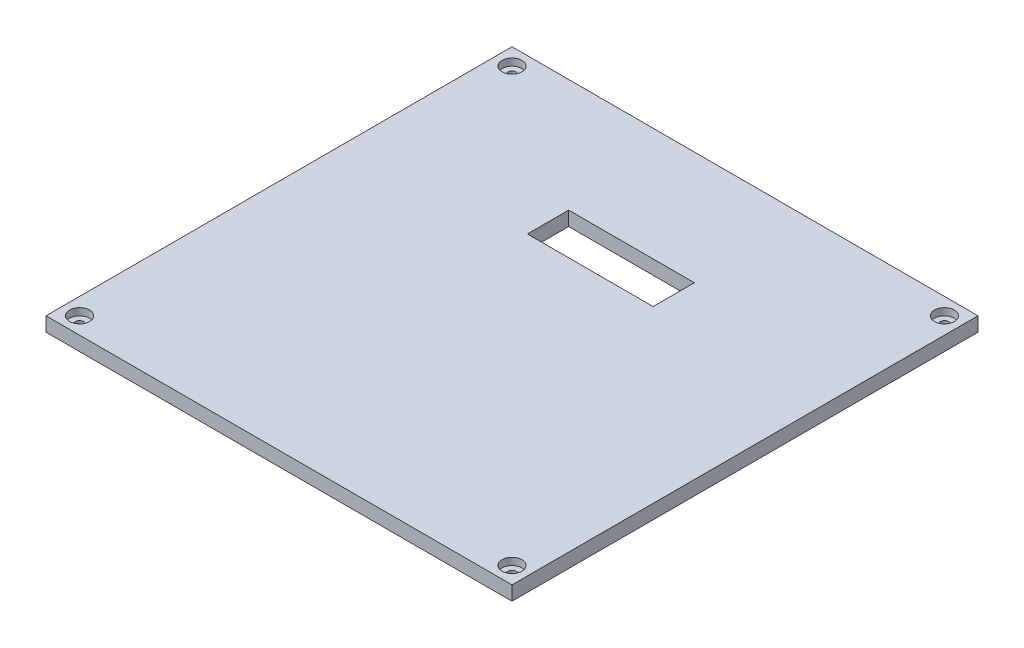
from build123d import *

# Parameters (mm, degrees)
SKETCH1_W                                  = 416.08
SKETCH1_H                                  = 416.08
BOSS_EXTRUDE1_DEPTH                        = 12.7
SKETCH2_R                                  = 3.683
CUT_EXTRUDE1_DEPTH                         = 589.563015148
SKETCH3_R                                  = 8.89
CUT_EXTRUDE2_DEPTH                         = 6.35
MIRROR1_AT_THE_SECOND_PLANE_COPY_1_SKETC_R = 3.683
MIRROR1_AT_THE_SECOND_PLANE_COPY_1_DEPTH   = 589.563015148
MIRROR1_AT_THE_SECOND_PLANE_COPY_2_SKETC_R = 8.89
MIRROR1_AT_THE_SECOND_PLANE_COPY_2_DEPTH   = 6.35
CUT_EXTRUDE3_REACH                         = 590.563
SKETCH4_W                                  = 112.243977319
SKETCH4_H                                  = 36.843442936


with BuildPart() as part:
    # Sketch1 → Boss-Extrude1 (new body)
    with BuildSketch(Plane(origin=(0, 0, 0), x_dir=(1, 0, 0), z_dir=(0, 1, 0))):
        with Locations((208.04, 208.04)):
            Rectangle(SKETCH1_W, SKETCH1_H)
    extrude(amount=BOSS_EXTRUDE1_DEPTH)

    # Sketch2 → Cut-Extrude1 (cut, through all)
    with BuildSketch(Plane(origin=(0, 12.7, 0), x_dir=(1, 0, 0), z_dir=(0, 1, 0))):
        with Locations(Location((14.986, 14.986, 0), (0, 0, 270))):
            Circle(SKETCH2_R)
    cut_extrude1 = extrude(amount=-CUT_EXTRUDE1_DEPTH, mode=Mode.SUBTRACT)

    # Sketch3 → Cut-Extrude2 (cut, symmetric)
    with BuildSketch(Plane(origin=(0, 12.7, 0), x_dir=(1, 0, 0), z_dir=(0, 1, 0))):
        with Locations(Location((14.986, 14.986, 0), (0, 0, 270))):
            Circle(SKETCH3_R)
    cut_extrude2 = extrude(amount=CUT_EXTRUDE2_DEPTH, both=True, mode=Mode.SUBTRACT)

    # Mirror1: Cut-Extrude1, Cut-Extrude2 across plane
    add(cut_extrude1.mirror(Plane(origin=(0, 0, -208.04), x_dir=(1, 0, 0), z_dir=(0, 0, -1))), mode=Mode.SUBTRACT)
    add(cut_extrude2.mirror(Plane(origin=(0, 0, -208.04), x_dir=(1, 0, 0), z_dir=(0, 0, -1))), mode=Mode.SUBTRACT)

    # Mirror1 at the second plane: Cut-Extrude1, Cut-Extrude2 across plane
    add(cut_extrude1.mirror(Plane.ZY.offset(-208.04)), mode=Mode.SUBTRACT)
    add(cut_extrude2.mirror(Plane.ZY.offset(-208.04)), mode=Mode.SUBTRACT)

    # Mirror1 at the second plane copy 1 sketc → Mirror1 at the second plane copy 1 (cut, through all)
    with BuildSketch(Plane(origin=(416.08, 12.7, -416.08), x_dir=(-1, 0, 0), z_dir=(0, 1, 0))):
        with Locations(Location((14.986, 14.986, 0), (0, 0, 270))):
            Circle(MIRROR1_AT_THE_SECOND_PLANE_COPY_1_SKETC_R)
    extrude(amount=-MIRROR1_AT_THE_SECOND_PLANE_COPY_1_DEPTH, mode=Mode.SUBTRACT)

    # Mirror1 at the second plane copy 2 sketc → Mirror1 at the second plane copy 2 (cut, symmetric)
    with BuildSketch(Plane(origin=(416.08, 12.7, -416.08), x_dir=(-1, 0, 0), z_dir=(0, 1, 0))):
        with Locations(Location((14.986, 14.986, 0), (0, 0, 270))):
            Circle(MIRROR1_AT_THE_SECOND_PLANE_COPY_2_SKETC_R)
    extrude(amount=MIRROR1_AT_THE_SECOND_PLANE_COPY_2_DEPTH, both=True, mode=Mode.SUBTRACT)

    # Sketch4 → Cut-Extrude3 (cut, up to next)
    with BuildSketch(Plane.XZ, mode=Mode.PRIVATE) as cut_extrude3_sk1:
        with Locations((207.758599761, -296.609069082)):
            Rectangle(SKETCH4_W, SKETCH4_H)
    cut_extrude3_tool1 = extrude(cut_extrude3_sk1.sketch, amount=-CUT_EXTRUDE3_REACH, mode=Mode.PRIVATE) & part.part
    add(cut_extrude3_tool1.solids().sort_by_distance((207.7586, 0, -296.609069))[0], mode=Mode.SUBTRACT)


solid = part.part
